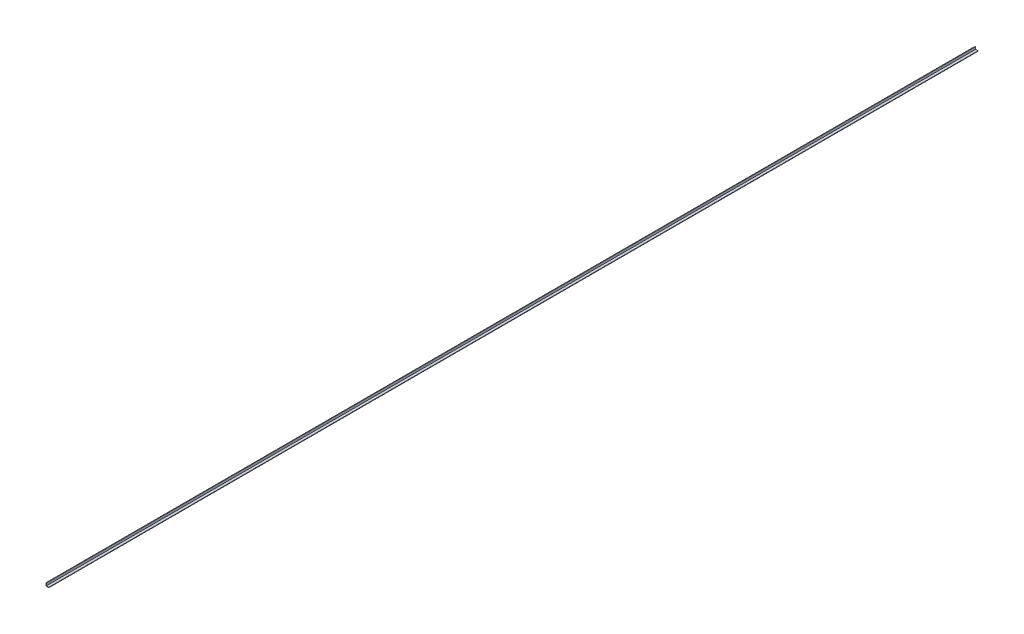
from build123d import *

# Parameters (mm, degrees)
SALIENTE_EXTRUIR1_DEPTH = 6100


with BuildPart() as part:
    # Croquis1 → Saliente-Extruir1 (new body)
    with BuildSketch(Plane.XY):
        Polygon((0, 19.05), (0, 0), (19.05, 0), (19.05, 3.18), (3.18, 3.18), (3.18, 19.05), align=None)
    extrude(amount=-SALIENTE_EXTRUIR1_DEPTH)


solid = part.part
